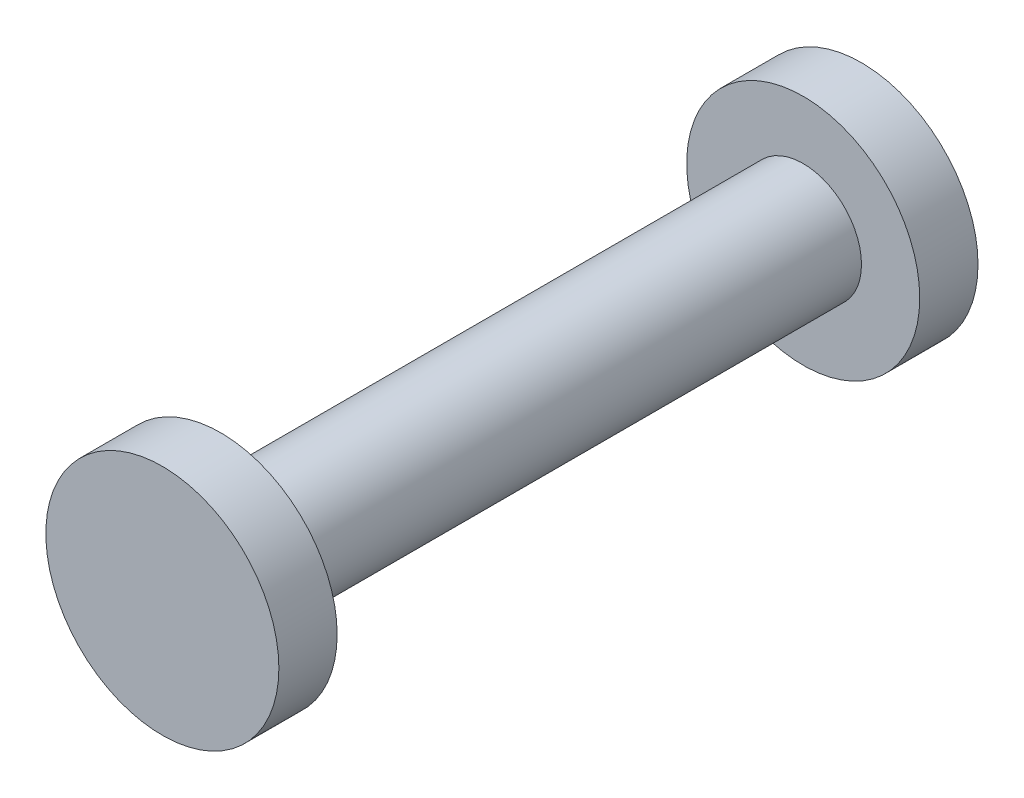
from build123d import *

# Parameters (mm, degrees)
SKETCH1_R           = 5
BOSS_EXTRUDE1_DEPTH = 25
SKETCH2_R           = 10
BOSS_EXTRUDE2_DEPTH = 5


with BuildPart() as part:
    # Sketch1 → Boss-Extrude1 (new, symmetric)
    with BuildSketch(Plane.XY):
        Circle(SKETCH1_R)
    extrude(amount=BOSS_EXTRUDE1_DEPTH, both=True)

    # Sketch2 → Boss-Extrude2 (add)
    with BuildSketch(Plane.XY.offset(25)):
        Circle(SKETCH2_R)
    boss_extrude2 = extrude(amount=BOSS_EXTRUDE2_DEPTH)

    # Mirror1: Boss-Extrude2 across plane
    add(boss_extrude2.mirror(Plane.XY))


solid = part.part
